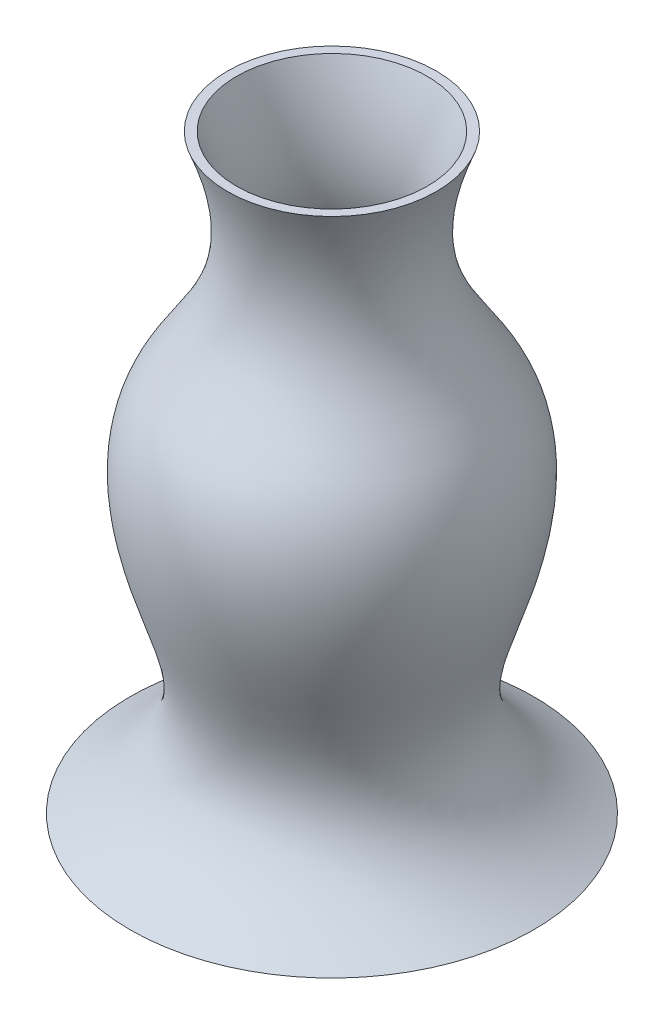
from build123d import *

# Parameters (mm, degrees)
SHELL1_T = -1.5


with BuildPart() as part:
    # Sketch1 → Revolve1 (revolve)
    with BuildSketch(Plane.XY):
        with BuildLine():
            Line((18.497286946, 23.538669378), (0, 23.538669378))
            Line((0, 23.538669378), (0, -81.069502006))
            Line((0, -81.069502006), (35.765017054, -81.069502006))
            add(Edge.make_bspline(
                [(18.497286946, 23.538669378), (9.714423327, 1.578202956), (31.709085733, -15.133276576), (26.071239005, -48.233902909), (14.973018994, -69.700712784), (35.765017054, -81.069502006)],
                knots=[0, 0, 0, 0, 0.292876565, 0.612996713, 1, 1, 1, 1], degree=3))
        make_face()
    revolve(axis=Axis((0, 23.538669378, 0), (0, -1, 0)))

    # Shell1
    shell1_openings = [part.faces().sort_by_distance(p)[0] for p in [
        (0, 23.538669378, 0),
    ]]
    offset(amount=SHELL1_T, openings=shell1_openings, kind=Kind.INTERSECTION)


solid = part.part
